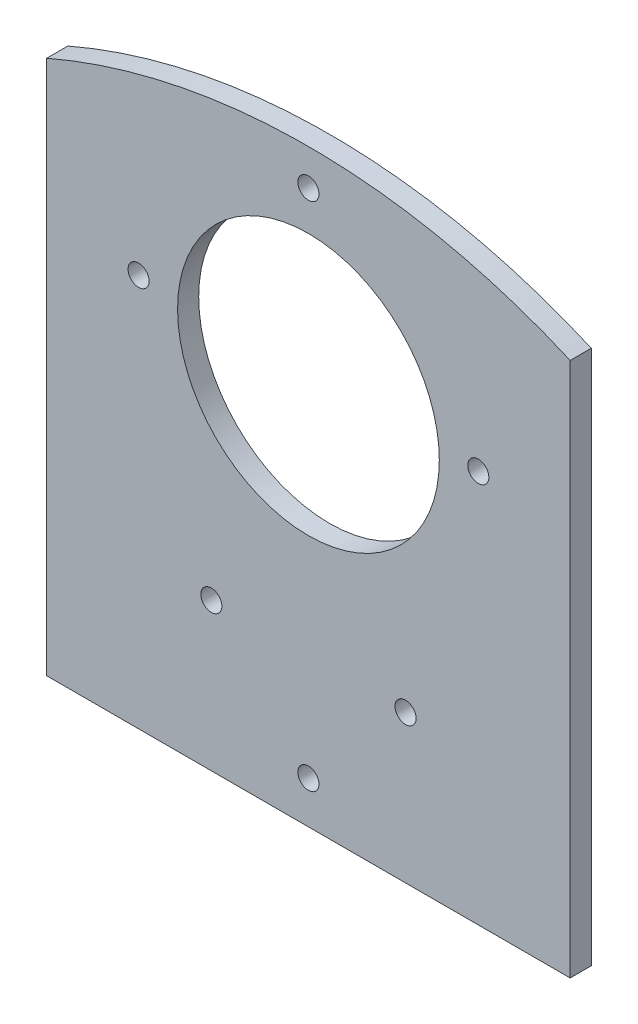
from build123d import *

# Parameters (mm, degrees)
SKETCH1_W           = 70
SKETCH1_H           = 105
BOSS_EXTRUDE1_DEPTH = 3
SKETCH2_R           = 17.5
CUT_EXTRUDE3_DEPTH  = 3
CUT_EXTRUDE6_DEPTH  = 10
SCALE1_SCALE        = 1.771428571
SKETCH6_R           = 30.999999993
CUT_EXTRUDE7_DEPTH  = 0.31
SKETCH7_W           = 123.99999997
SKETCH7_H           = 38.57142855
CUT_EXTRUDE8_DEPTH  = 10
SKETCH9_R           = 2.5
CUT_EXTRUDE9_DEPTH  = 5.004285713
SKETCH10_R          = 2.5
CUT_EXTRUDE10_DEPTH = 5.004285713


with BuildPart() as part:
    # Sketch1 → Boss-Extrude1 (new body)
    with BuildSketch(Plane.XY):
        Rectangle(SKETCH1_W, SKETCH1_H)
    extrude(amount=BOSS_EXTRUDE1_DEPTH)

    # Sketch2 → Cut-Extrude3 (cut)
    with BuildSketch(Plane(origin=(0, 0, 0), x_dir=(-1, 0, 0), z_dir=(0, 0, -1))):
        with Locations((0, 20.5)):
            Circle(SKETCH2_R)
    extrude(amount=-CUT_EXTRUDE3_DEPTH, mode=Mode.SUBTRACT)

    # Sketch5 → Cut-Extrude6 (cut)
    with BuildSketch(Plane.XY.offset(3)):
        with BuildLine():
            Line((-35, 40.793543502), (-35, 52.5))
            Line((-35, 52.5), (35, 52.5))
            Line((35, 52.5), (35, 40.793543502))
            ThreePointArc((35, 40.793543502), (0, 48.07644174), (-35, 40.793543502))
        make_face()
    extrude(amount=-CUT_EXTRUDE6_DEPTH, mode=Mode.SUBTRACT)


with BuildPart() as part_1:
    # Scale1: scaled about (0, -7.267874882, 1.5)
    add(part.part.scale(SCALE1_SCALE).moved(Location((0, 5.606646334, -1.157142856))))

    # Sketch6 → Cut-Extrude7 (cut)
    with BuildSketch(Plane(origin=(0, 0, -1.157142856), x_dir=(-1, 0, 0), z_dir=(0, 0, -1))):
        with BuildLine():
            Line((61.999999985, -87.393353643), (61.999999985, 77.869494806))
            ThreePointArc((61.999999985, 77.869494806), (0, 90.770628825), (-61.999999985, 77.869494806))
            Line((-61.999999985, 77.869494806), (-61.999999985, -87.393353643))
            Line((-61.999999985, -87.393353643), (61.999999985, -87.393353643))
        make_face()
        with Locations((0, 41.92093204)):
            Circle(SKETCH6_R, mode=Mode.SUBTRACT)
    extrude(amount=-CUT_EXTRUDE7_DEPTH, mode=Mode.SUBTRACT)

    # Sketch7 → Cut-Extrude8 (cut)
    with BuildSketch(Plane.XY.offset(4.157142857)):
        with Locations((0, -68.107639368)):
            Rectangle(SKETCH7_W, SKETCH7_H)
    extrude(amount=-CUT_EXTRUDE8_DEPTH, mode=Mode.SUBTRACT)

    # Sketch9 → Cut-Extrude9 (cut)
    with BuildSketch(Plane.XY.offset(4.157142857)):
        with Locations((23, -13.821925093)):
            Circle(SKETCH9_R)
        with Locations((-23, -13.821925093)):
            Circle(SKETCH9_R)
        with Locations((0, -38.821925093)):
            Circle(SKETCH9_R)
    extrude(amount=-CUT_EXTRUDE9_DEPTH, mode=Mode.SUBTRACT)

    # Sketch10 → Cut-Extrude10 (cut)
    with BuildSketch(Plane.XY.offset(4.157142857)):
        with Locations((-40.233402491, 44.236817184)):
            Circle(SKETCH10_R)
        with Locations((0, 82.22093204)):
            Circle(SKETCH10_R)
        with Locations((40.233400771, 44.236847056)):
            Circle(SKETCH10_R)
    extrude(amount=-CUT_EXTRUDE10_DEPTH, mode=Mode.SUBTRACT)


solid = part_1.part
